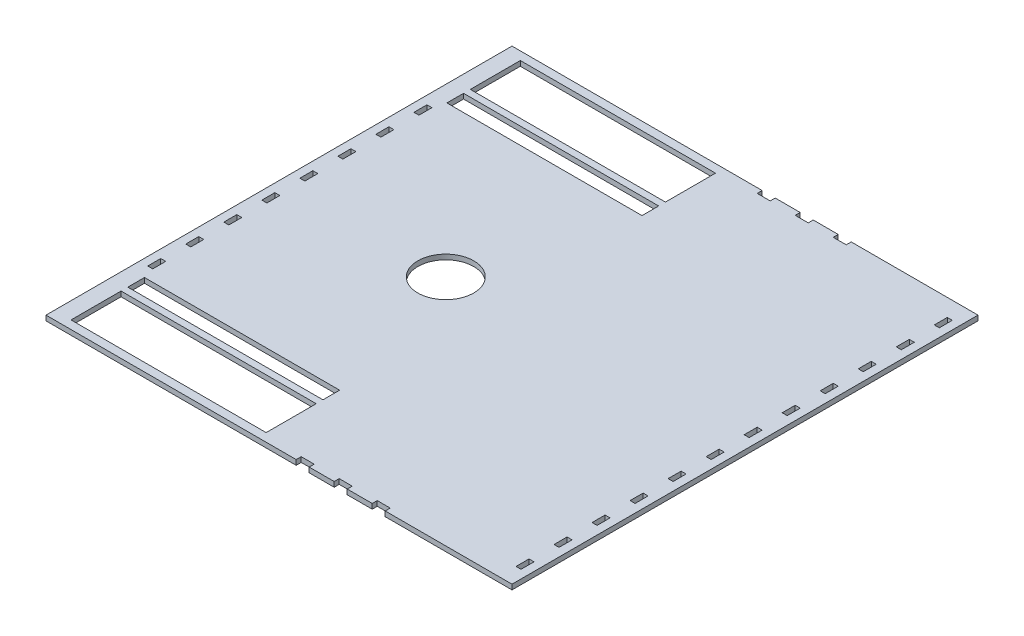
from build123d import *

# Parameters (mm, degrees)
SKETCH1_W               = 279.4
SKETCH1_H               = 279.4
SKETCH1_W_2             = 117
SKETCH1_H_2             = 30
BOSS_EXTRUDE1_DEPTH     = 3
SKETCH2_W               = 117
SKETCH2_H               = 10
CUT_EXTRUDE1_DEPTH      = 10
SKETCH3_W               = 3
SKETCH3_H               = 7.8
CUT_EXTRUDE2_DEPTH      = 198.588410591
LPATTERN1_COUNT         = 12
LPATTERN1_PITCH         = 22.8
SKETCH5_W               = 7.8
SKETCH5_H               = 3
CUT_EXTRUDE3_DEPTH      = 198.588410591
LPATTERN2_COUNT         = 3
LPATTERN2_PITCH         = 22.8
MIRROR2_COPY_1_SKETCH_W = 7.8
MIRROR2_COPY_1_SKETCH_H = 3
MIRROR2_COPY_1_DEPTH    = 198.588410591
MIRROR2_COPY_2_SKETCH_W = 7.8
MIRROR2_COPY_2_SKETCH_H = 3
MIRROR2_COPY_2_DEPTH    = 198.588410591
SKETCH6_W               = 3
SKETCH6_H               = 7.8
CUT_EXTRUDE4_DEPTH      = 198.588410591
LPATTERN3_COUNT         = 8
LPATTERN3_PITCH         = 22.8
SKETCH7_R               = 16.75
CUT_EXTRUDE5_DEPTH      = 198.588410591


with BuildPart() as part:
    # Sketch1 → Boss-Extrude1 (new body)
    with BuildSketch(Plane(origin=(0, 0, 0), x_dir=(1, 0, 0), z_dir=(0, 1, 0))):
        Rectangle(SKETCH1_W, SKETCH1_H)
        with Locations((-71.2, 119.7)):
            Rectangle(SKETCH1_W_2, SKETCH1_H_2, mode=Mode.SUBTRACT)
        with Locations((-71.2, -119.7)):
            Rectangle(SKETCH1_W_2, SKETCH1_H_2, mode=Mode.SUBTRACT)
    extrude(amount=BOSS_EXTRUDE1_DEPTH)

    # Sketch2 → Cut-Extrude1 (cut)
    with BuildSketch(Plane(origin=(0, 3, 0), x_dir=(1, 0, 0), z_dir=(0, 1, 0))):
        with Locations((-71.2, 95.65)):
            Rectangle(SKETCH2_W, SKETCH2_H)
    cut_extrude1 = extrude(amount=-CUT_EXTRUDE1_DEPTH, mode=Mode.SUBTRACT)

    # Mirror1: Cut-Extrude1 across plane
    add(cut_extrude1.mirror(Plane.XY), mode=Mode.SUBTRACT)

    # Sketch3 → Cut-Extrude2 (cut, through all)
    with BuildSketch(Plane(origin=(0, 0, 0), x_dir=(-1, 0, 0), z_dir=(0, -1, 0))):
        with Locations((-133.2, 125.4)):
            Rectangle(SKETCH3_W, SKETCH3_H)
    cut_extrude2 = extrude(amount=-CUT_EXTRUDE2_DEPTH, mode=Mode.SUBTRACT)

    # LPattern1: Cut-Extrude2 ×12
    with Locations(*[(0, 0, i * LPATTERN1_PITCH) for i in range(1, LPATTERN1_COUNT)]):
        add(cut_extrude2, mode=Mode.SUBTRACT)

    # Sketch5 → Cut-Extrude3 (cut, through all)
    with BuildSketch(Plane.XZ):
        with Locations((59.8, -138.2)):
            Rectangle(SKETCH5_W, SKETCH5_H)
    cut_extrude3 = extrude(amount=-CUT_EXTRUDE3_DEPTH, mode=Mode.SUBTRACT)

    # LPattern2: Cut-Extrude3 ×3
    with Locations(*[(-i * LPATTERN2_PITCH, 0, 0) for i in range(1, LPATTERN2_COUNT)]):
        add(cut_extrude3, mode=Mode.SUBTRACT)

    # Mirror2: Cut-Extrude3 across plane
    add(cut_extrude3.mirror(Plane.XY), mode=Mode.SUBTRACT)

    # Mirror2 copy 1 sketch → Mirror2 copy 1 (cut, through all)
    with BuildSketch(Plane(origin=(-22.8, 0, 0), x_dir=(1, 0, 0), z_dir=(0, -1, 0))):
        with Locations((59.8, 138.2)):
            Rectangle(MIRROR2_COPY_1_SKETCH_W, MIRROR2_COPY_1_SKETCH_H)
    extrude(amount=-MIRROR2_COPY_1_DEPTH, mode=Mode.SUBTRACT)

    # Mirror2 copy 2 sketch → Mirror2 copy 2 (cut, through all)
    with BuildSketch(Plane(origin=(-45.6, 0, 0), x_dir=(1, 0, 0), z_dir=(0, -1, 0))):
        with Locations((59.8, 138.2)):
            Rectangle(MIRROR2_COPY_2_SKETCH_W, MIRROR2_COPY_2_SKETCH_H)
    extrude(amount=-MIRROR2_COPY_2_DEPTH, mode=Mode.SUBTRACT)

    # Sketch6 → Cut-Extrude4 (cut, through all)
    with BuildSketch(Plane.XZ):
        with Locations((-133.2, -79.8)):
            Rectangle(SKETCH6_W, SKETCH6_H)
    cut_extrude4 = extrude(amount=-CUT_EXTRUDE4_DEPTH, mode=Mode.SUBTRACT)

    # LPattern3: Cut-Extrude4 ×8
    with Locations(*[(0, 0, i * LPATTERN3_PITCH) for i in range(1, LPATTERN3_COUNT)]):
        add(cut_extrude4, mode=Mode.SUBTRACT)

    # Sketch7 → Cut-Extrude5 (cut, through all)
    with BuildSketch(Plane(origin=(0, 0, 0), x_dir=(-1, 0, 0), z_dir=(0, -1, 0))):
        with Locations(Location((39.7, 0, 0), (0, 0, 90))):
            Circle(SKETCH7_R)
    extrude(amount=-CUT_EXTRUDE5_DEPTH, mode=Mode.SUBTRACT)


solid = part.part
